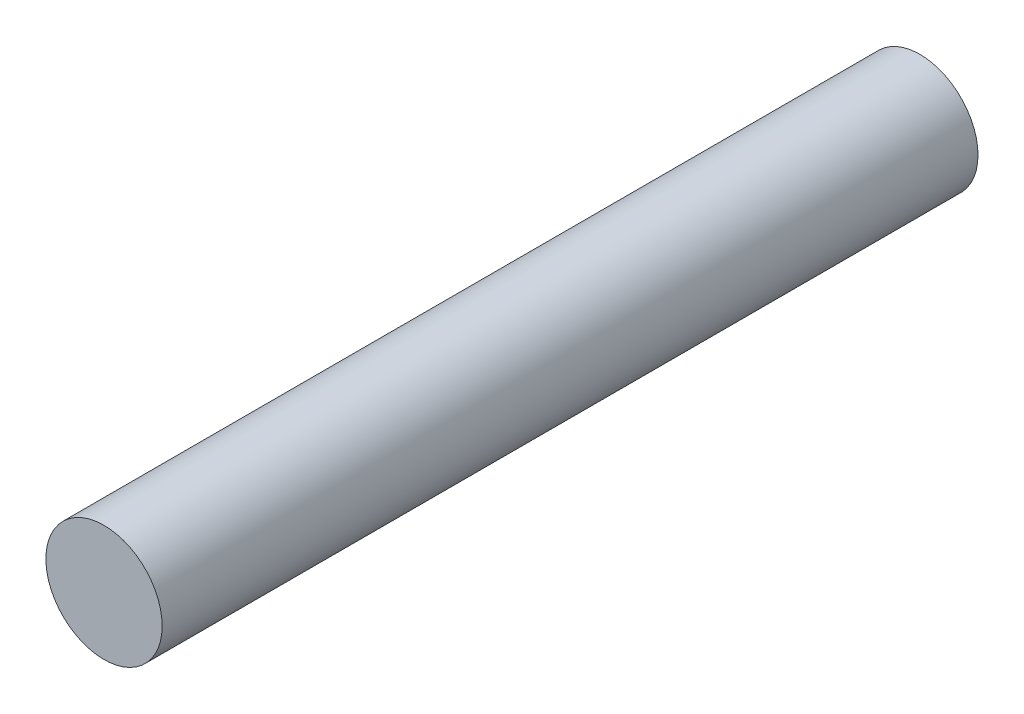
from build123d import *

# Parameters (mm, degrees)
SKETCH_1_R      = 2.85
EXTRUDE_1_DEPTH = 40


with BuildPart() as part:
    # 草图1 → 凸台-拉伸1 (new body)
    with BuildSketch(Plane.XY):
        Circle(SKETCH_1_R)
    extrude(amount=EXTRUDE_1_DEPTH)


solid = part.part
